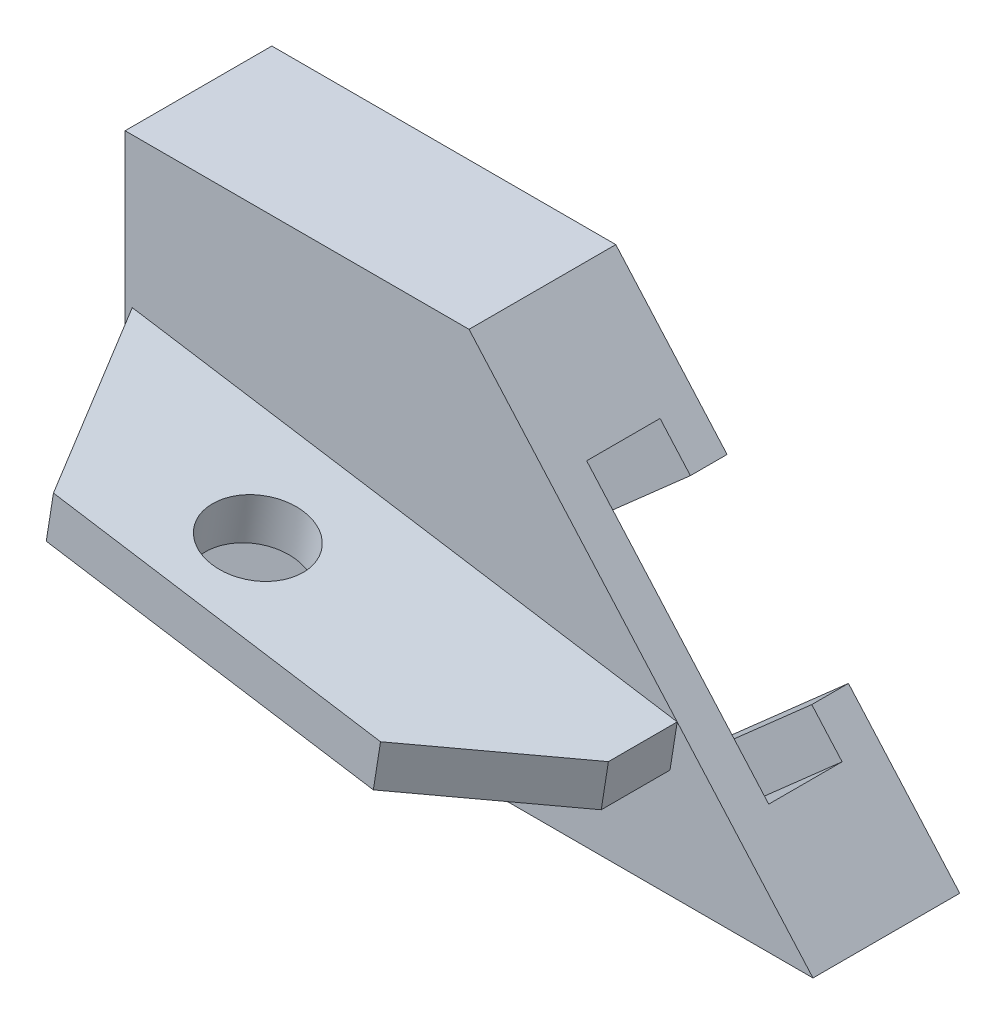
from build123d import *

# Parameters (mm, degrees)
BOSS_EXTRUDE1_DEPTH   = 32
BOSS_EXTRUDE1_2_DEPTH = 32
BOSS_EXTRUDE2_DEPTH   = 72
CUT_EXTRUDE1_REACH    = 135.547
CUT_EXTRUDE2_REACH    = 168.292
SKETCH3_R             = 10


with BuildPart() as part:
    # Sketch1 → Boss-Extrude1 (new body)
    with BuildSketch(Plane.XY):
        Polygon((0, 42.5), (1.56434465, 52.376883406), (120.39128367, 33.556545174), (75, 85), (0, 85), align=None)
    extrude(amount=BOSS_EXTRUDE1_DEPTH)



with BuildPart() as body_2:
    # Sketch1 → Boss-Extrude1 2 (new body)
    with BuildSketch(Plane.XY):
        Polygon((150, 0), (120.39128367, 33.556545174), (118.82693902, 23.679661768), (0, 42.5), (0, 0), align=None)
    extrude(amount=BOSS_EXTRUDE1_2_DEPTH)


with BuildPart() as part_1:
    add(part.part)

    add(body_2.part)  # Boss-Extrude2 merges body 2
    # Sketch1<4> → Boss-Extrude2 (add)
    with BuildSketch(Plane.XY):
        Polygon((120.39128367, 33.556545174), (1.56434465, 52.376883406), (0, 42.5), (118.82693902, 23.679661768), align=None)
    extrude(amount=BOSS_EXTRUDE2_DEPTH)

    # Sketch2 → Cut-Extrude1 (cut, up to next)
    with BuildSketch(Plane(origin=(84.338521401, 74.416342412, 0), x_dir=(0, 0, -1), z_dir=(0.7498378553650925, 0.6616216370868464, 0)), mode=Mode.PRIVATE) as cut_extrude1_sk1:
        Polygon((0, -22.564325319), (-8, -22.564325319), (-8, -12.564325319), (-24, -12.564325319), (-24, -72.564325319), (-8, -72.564325319), (-8, -62.564325319), (0, -62.564325319), align=None)
    cut_extrude1_tool1 = extrude(cut_extrude1_sk1.sketch, amount=-CUT_EXTRUDE1_REACH, mode=Mode.PRIVATE) & part_1.part
    add(cut_extrude1_tool1.solids().sort_by_distance((112.5, 42.5, 13))[0], mode=Mode.SUBTRACT)

    # Sketch3 → Cut-Extrude2 (cut, up to next)
    with BuildSketch(Plane(origin=(6.56661113, 41.459950971, 0), x_dir=(0.9876883405951378, -0.1564344650402311, 0), z_dir=(-0.1564344650402311, -0.9876883405951378, 0)), mode=Mode.PRIVATE) as cut_extrude2_sk1:
        Polygon((-6.648464764, 72), (-6.648464764, 32), (16.445546003, 72), align=None)
    cut_extrude2_tool1 = extrude(cut_extrude2_sk1.sketch, amount=-CUT_EXTRUDE2_REACH, mode=Mode.PRIVATE) & part_1.part
    # Sketch3 → Cut-Extrude2 (cut, up to next)
    with BuildSketch(Plane(origin=(6.56661113, 41.459950971, 0), x_dir=(0.9876883405951378, -0.1564344650402311, 0), z_dir=(-0.1564344650402311, -0.9876883405951378, 0)), mode=Mode.PRIVATE) as cut_extrude2_sk2:
        Polygon((113.659666997, 72), (88.659666997, 72), (113.659666997, 47), align=None)
    cut_extrude2_tool2 = extrude(cut_extrude2_sk2.sketch, amount=-CUT_EXTRUDE2_REACH, mode=Mode.PRIVATE) & part_1.part
    # Sketch3 → Cut-Extrude2 (cut, up to next)
    with BuildSketch(Plane(origin=(6.56661113, 41.459950971, 0), x_dir=(0.9876883405951378, -0.1564344650402311, 0), z_dir=(-0.1564344650402311, -0.9876883405951378, 0)), mode=Mode.PRIVATE) as cut_extrude2_sk3:
        with Locations((43.351535236, 54)):
            Circle(SKETCH3_R)
    cut_extrude2_tool3 = extrude(cut_extrude2_sk3.sketch, amount=-CUT_EXTRUDE2_REACH, mode=Mode.PRIVATE) & part_1.part
    add(cut_extrude2_tool1.solids().sort_by_distance((7.603228, 41.295767, 58.666667))[0], mode=Mode.SUBTRACT)
    add(cut_extrude2_tool2.solids().sort_by_distance((110.596203, 24.983282, 63.666667))[0], mode=Mode.SUBTRACT)
    add(cut_extrude2_tool3.solids().sort_by_distance((49.384417, 34.678277, 54))[0], mode=Mode.SUBTRACT)


solid = part_1.part
